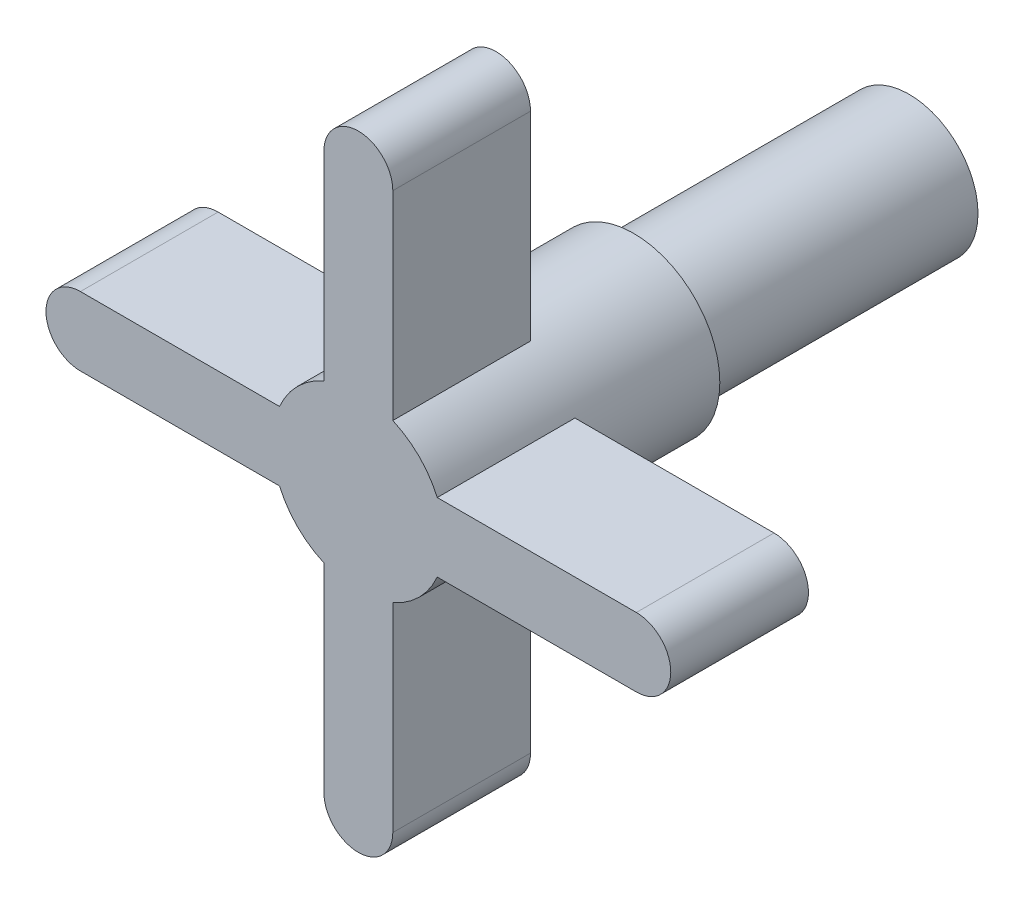
from build123d import *

# Parameters (mm, degrees)
BOSS_EXTRUDE1_DEPTH = 20
SKETCH2_R           = 10
BOSS_EXTRUDE2_DEPTH = 80
SKETCH3_R           = 12.5
BOSS_EXTRUDE3_DEPTH = 40


with BuildPart() as part:
    # Sketch1 → Boss-Extrude1 (new body)
    with BuildSketch(Plane.XY):
        with BuildLine():
            Line((-40.373207368, -5), (-5, -5))
            Line((-5, -5), (-5, -40.373207368))
            ThreePointArc((-5, -40.373207368), (0, -45.373207368), (5, -40.373207368))
            Line((5, -40.373207368), (5, -5))
            Line((5, -5), (40.373207368, -5))
            ThreePointArc((40.373207368, -5), (45.373207368, 0), (40.373207368, 5))
            Line((40.373207368, 5), (5, 5))
            Line((5, 5), (5, 40.373207368))
            ThreePointArc((5, 40.373207368), (0, 45.373207368), (-5, 40.373207368))
            Line((-5, 40.373207368), (-5, 5))
            Line((-5, 5), (-40.373207368, 5))
            ThreePointArc((-40.373207368, 5), (-45.373207368, 0), (-40.373207368, -5))
        make_face()
    extrude(amount=BOSS_EXTRUDE1_DEPTH)

    # Sketch2 → Boss-Extrude2 (add)
    with BuildSketch(Plane.XY.offset(20)):
        Circle(SKETCH2_R)
    extrude(amount=-BOSS_EXTRUDE2_DEPTH)

    # Sketch3 → Boss-Extrude3 (add)
    with BuildSketch(Plane.XY.offset(20)):
        Circle(SKETCH3_R)
    extrude(amount=-BOSS_EXTRUDE3_DEPTH)


solid = part.part
